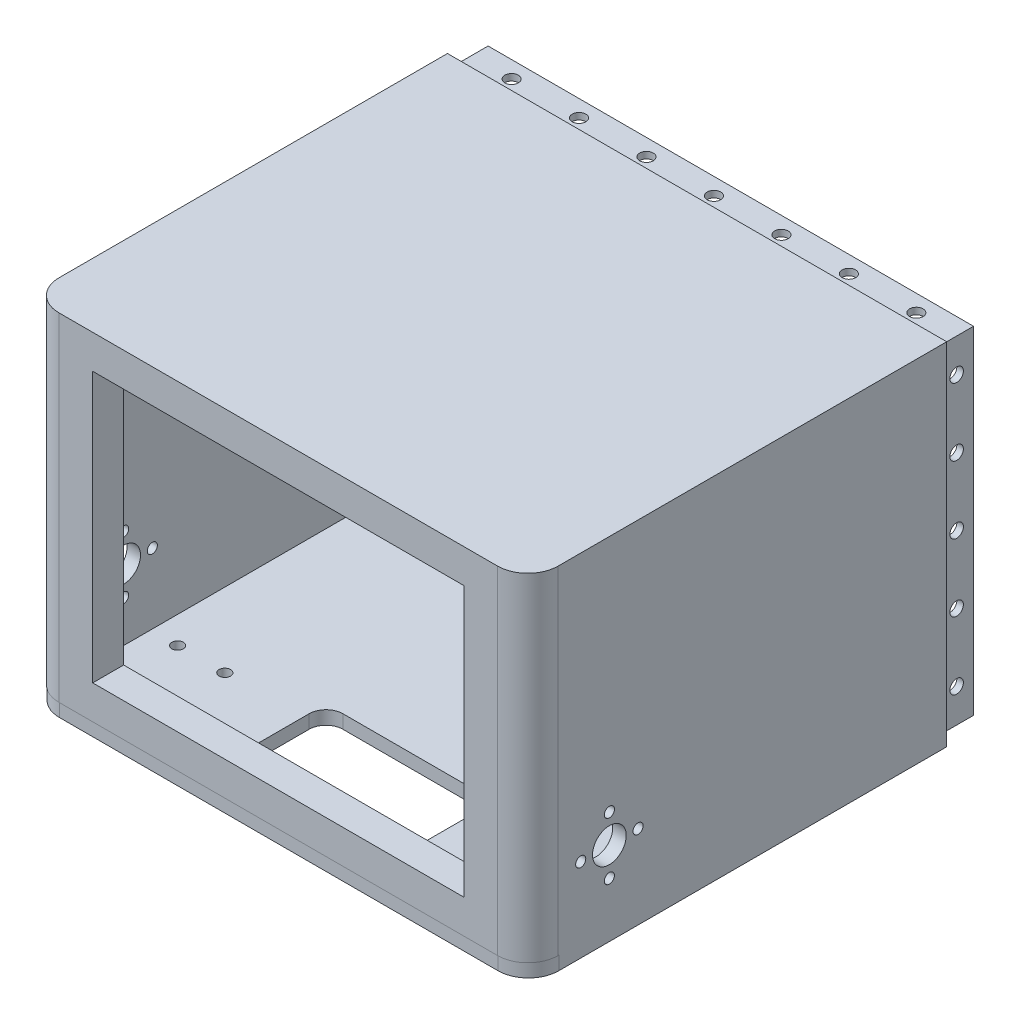
from build123d import *

# Parameters (mm, degrees)
SKETCH_1_R           = 1.7
EXTRUDE_6_DEPTH      = 4
EXTRUDE_7_DEPTH      = 100
SKETCH_10_W          = 140
SKETCH_10_H          = 96
CUT_EXTRUDE_20_DEPTH = 115
CUT_EXTRUDE_START    = -148
SKETCH_16_R          = 1.5
SKETCH_16_R_2        = 4
CUT_EXTRUDE_22_DEPTH = 148
SKETCH_21_W          = 110
SKETCH_21_H          = 80
CUT_EXTRUDE_28_DEPTH = 50
SKETCH_23_R          = 5
CUT_EXTRUDE_29_DEPTH = 148
SKETCH_31_W          = 143.9
SKETCH_31_H          = 99.9
SKETCH_31_W_2        = 140
SKETCH_31_H_2        = 96
EXTRUDE_9_DEPTH      = 10
CUT_EXTRUDE_START_2  = -99.9
SKETCH_32_R          = 2
CUT_EXTRUDE_32_DEPTH = 99.9
CUT_EXTRUDE_START_3  = -143.9
SKETCH_33_R          = 2
CUT_EXTRUDE_33_DEPTH = 143.9


with BuildPart() as part:
    # 草图1 → 凸台-拉伸6 (new body)
    with BuildSketch(Plane(origin=(0, 0, 0), x_dir=(1, 0, 0), z_dir=(0, 1, 0))):
        with BuildLine():
            Line((-74, 0), (-74, -115))
            ThreePointArc((-74, -115), (-71.363961031, -121.363961031), (-65, -124))
            Line((-65, -124), (65, -124))
            ThreePointArc((65, -124), (71.363961031, -121.363961031), (74, -115))
            Line((74, -115), (74, 0))
            Line((74, 0), (-74, 0))
        make_face()
        with Locations(Location((-62, -108, 0), (0, 0, 270))):
            Circle(SKETCH_1_R, mode=Mode.SUBTRACT)
        with Locations(Location((-48, -108, 0), (0, 0, 270))):
            Circle(SKETCH_1_R, mode=Mode.SUBTRACT)
        with Locations(Location((48, -108, 0), (0, 0, 270))):
            Circle(SKETCH_1_R, mode=Mode.SUBTRACT)
        with Locations(Location((62, -108, 0), (0, 0, 270))):
            Circle(SKETCH_1_R, mode=Mode.SUBTRACT)
        with Locations(Location((-62, -92, 0), (0, 0, 270))):
            Circle(SKETCH_1_R, mode=Mode.SUBTRACT)
        with Locations(Location((-48, -92, 0), (0, 0, 270))):
            Circle(SKETCH_1_R, mode=Mode.SUBTRACT)
        with BuildLine():
            ThreePointArc((-25, -90), (-23.535533906, -86.464466094), (-20, -85))
            Line((-20, -85), (20, -85))
            ThreePointArc((20, -85), (23.535533906, -86.464466094), (25, -90))
            Line((25, -90), (25, -107.989151936))
            ThreePointArc((25, -107.989151936), (23.535533906, -111.524685842), (20, -112.989151936))
            Line((20, -112.989151936), (-20, -112.989151936))
            ThreePointArc((-20, -112.989151936), (-23.535533906, -111.524685842), (-25, -107.989151936))
            Line((-25, -107.989151936), (-25, -90))
        make_face(mode=Mode.SUBTRACT)
        with Locations(Location((48, -92, 0), (0, 0, 270))):
            Circle(SKETCH_1_R, mode=Mode.SUBTRACT)
        with Locations(Location((62, -92, 0), (0, 0, 270))):
            Circle(SKETCH_1_R, mode=Mode.SUBTRACT)
    extrude(amount=EXTRUDE_6_DEPTH)

    # 草图9 → 凸台-拉伸7 (add)
    with BuildSketch(Plane(origin=(0, 4, 0), x_dir=(1, 0, 0), z_dir=(0, 1, 0))):
        with BuildLine():
            Line((-74, 0), (74, 0))
            Line((74, 0), (74, -115.166586314))
            ThreePointArc((74, -115.166586314), (71.363961031, -121.530547345), (65, -124.166586314))
            Line((65, -124.166586314), (-65, -124.166586314))
            ThreePointArc((-65, -124.166586314), (-71.363961031, -121.530547345), (-74, -115.166586314))
            Line((-74, -115.166586314), (-74, 0))
        make_face()
    extrude(amount=EXTRUDE_7_DEPTH)

    # 草图10 → 切除-拉伸20 (cut)
    with BuildSketch(Plane(origin=(0, 0, 0), x_dir=(-1, 0, 0), z_dir=(0, 0, -1))):
        with Locations((0, 52)):
            Rectangle(SKETCH_10_W, SKETCH_10_H)
    extrude(amount=-CUT_EXTRUDE_20_DEPTH, mode=Mode.SUBTRACT)

    # 草图16 → 切除-拉伸22 (cut)
    with BuildSketch(Plane.ZY.offset(74).offset(CUT_EXTRUDE_START)):
        with Locations(Location((100, 16.25, 0), (0, 0, 180))):
            Circle(SKETCH_16_R)
        with Locations(Location((108.5, 24.75, 0), (0, 0, 180))):
            Circle(SKETCH_16_R)
        with Locations(Location((100, 24.75, 0), (0, 0, 180))):
            Circle(SKETCH_16_R_2)
        with Locations(Location((91.5, 24.75, 0), (0, 0, 180))):
            Circle(SKETCH_16_R)
        with Locations(Location((100, 33.25, 0), (0, 0, 180))):
            Circle(SKETCH_16_R)
    extrude(amount=CUT_EXTRUDE_22_DEPTH, mode=Mode.SUBTRACT)

    # 草图21 → 切除-拉伸28 (cut)
    with BuildSketch(Plane.XY.offset(124.166586314)):
        with Locations((0, 54)):
            Rectangle(SKETCH_21_W, SKETCH_21_H)
    extrude(amount=-CUT_EXTRUDE_28_DEPTH, mode=Mode.SUBTRACT)

    # 草图23 → 切除-拉伸29 (cut)
    with BuildSketch(Plane.ZY.offset(74).offset(CUT_EXTRUDE_START)):
        with Locations((100, 24.75)):
            Circle(SKETCH_23_R)
    extrude(amount=CUT_EXTRUDE_29_DEPTH, mode=Mode.SUBTRACT)

    # 草图31 → 凸台-拉伸9 (add)
    with BuildSketch(Plane(origin=(0, 0, 0), x_dir=(-1, 0, 0), z_dir=(0, 0, -1))):
        with Locations((0, 52)):
            Rectangle(SKETCH_31_W, SKETCH_31_H)
        with Locations((0, 52)):
            Rectangle(SKETCH_31_W_2, SKETCH_31_H_2, mode=Mode.SUBTRACT)
    extrude(amount=EXTRUDE_9_DEPTH)

    # 草图32 → 切除-拉伸32 (cut)
    with BuildSketch(Plane(origin=(0, 101.95, 0), x_dir=(1, 0, 0), z_dir=(0, 1, 0)).offset(CUT_EXTRUDE_START_2)):
        with Locations(Location((0, 5, 0), (0, 0, 180))):
            Circle(SKETCH_32_R)
        with Locations(Location((20, 5, 0), (0, 0, 180))):
            Circle(SKETCH_32_R)
        with Locations(Location((40, 5, 0), (0, 0, 180))):
            Circle(SKETCH_32_R)
        with Locations(Location((60, 5, 0), (0, 0, 180))):
            Circle(SKETCH_32_R)
        with Locations(Location((-60, 5, 0), (0, 0, 180))):
            Circle(SKETCH_32_R)
        with Locations(Location((-20, 5, 0), (0, 0, 180))):
            Circle(SKETCH_32_R)
        with Locations(Location((-40, 5, 0), (0, 0, 180))):
            Circle(SKETCH_32_R)
    extrude(amount=CUT_EXTRUDE_32_DEPTH, mode=Mode.SUBTRACT)

    # 草图33 → 切除-拉伸33 (cut)
    with BuildSketch(Plane.ZY.offset(71.95).offset(CUT_EXTRUDE_START_3)):
        with Locations(Location((-5, 52, 0), (0, 0, 90))):
            Circle(SKETCH_33_R)
        with Locations(Location((-5, 72, 0), (0, 0, 90))):
            Circle(SKETCH_33_R)
        with Locations(Location((-5, 92, 0), (0, 0, 90))):
            Circle(SKETCH_33_R)
        with Locations(Location((-5, 12, 0), (0, 0, 90))):
            Circle(SKETCH_33_R)
        with Locations(Location((-5, 32, 0), (0, 0, 90))):
            Circle(SKETCH_33_R)
    extrude(amount=CUT_EXTRUDE_33_DEPTH, mode=Mode.SUBTRACT)


solid = part.part
